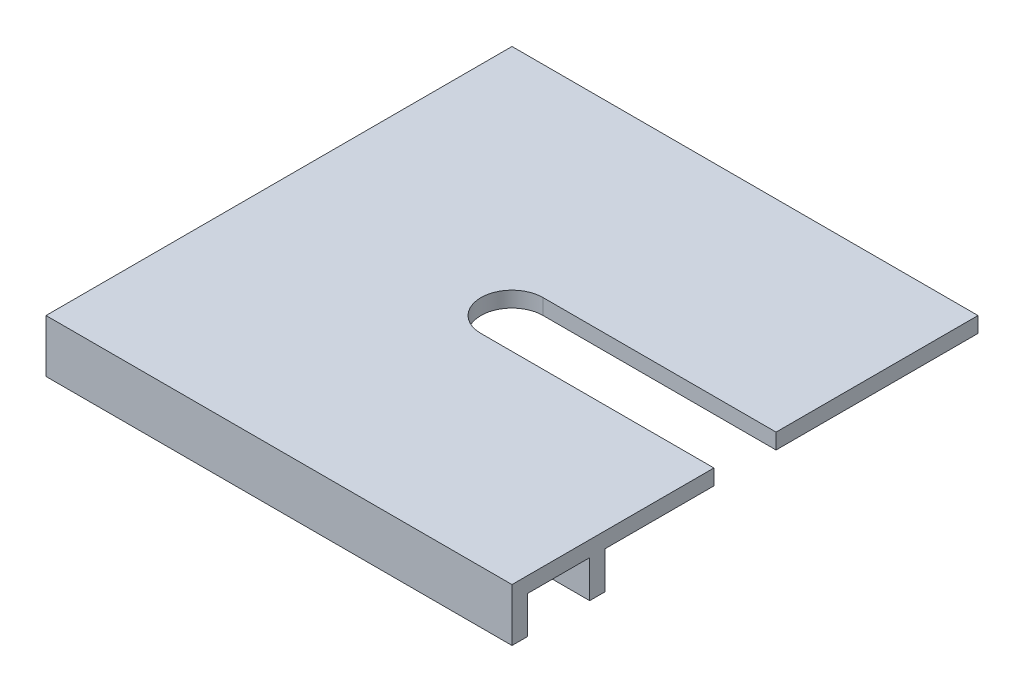
from build123d import *

# Parameters (mm, degrees)
BOSS_EXTRUDE1_DEPTH = 2
BOSS_EXTRUDE2_DEPTH = 5
CHAMFER1_SIZE       = 0.2


with BuildPart() as part:
    # Sketch1 → Boss-Extrude1 (new body)
    with BuildSketch(Plane(origin=(0, 0, 0), x_dir=(1, 0, 0), z_dir=(0, 1, 0))):
        with BuildLine():
            Line((60, 26), (30, 26))
            ThreePointArc((30, 26), (26, 30), (30, 34))
            Line((30, 34), (60, 34))
            Line((60, 34), (60, 60))
            Line((60, 60), (0, 60))
            Line((0, 60), (0, 0))
            Line((0, 0), (60, 0))
            Line((60, 0), (60, 26))
        make_face()
    extrude(amount=BOSS_EXTRUDE1_DEPTH)

    # Sketch2 → Boss-Extrude2 (add)
    with BuildSketch(Plane.XZ):
        Polygon((60, -12), (60, -10), (10, -10), (10, -60), (12, -60), (12, -12), align=None)
        Polygon((60, -2), (60, 0), (0, 0), (0, -60), (2, -60), (2, -10), (2, -2), (10, -2), align=None)
    extrude(amount=BOSS_EXTRUDE2_DEPTH)

    # Chamfer1
    chamfer1_edges = [part.edges().sort_by_distance(p)[0] for p in [
        (35, -5, -10),
        (10, -5, -35),
        (11, -5, -60),
        (12, -5, -36),
        (36, -5, -12),
        (60, -5, -11),
        (2, -5, -31),
        (31, -5, -2),
        (60, -5, -1),
        (30, -5, 0),
        (0, -5, -30),
        (1, -5, -60),
    ]]
    chamfer(chamfer1_edges, length=CHAMFER1_SIZE)


solid = part.part
